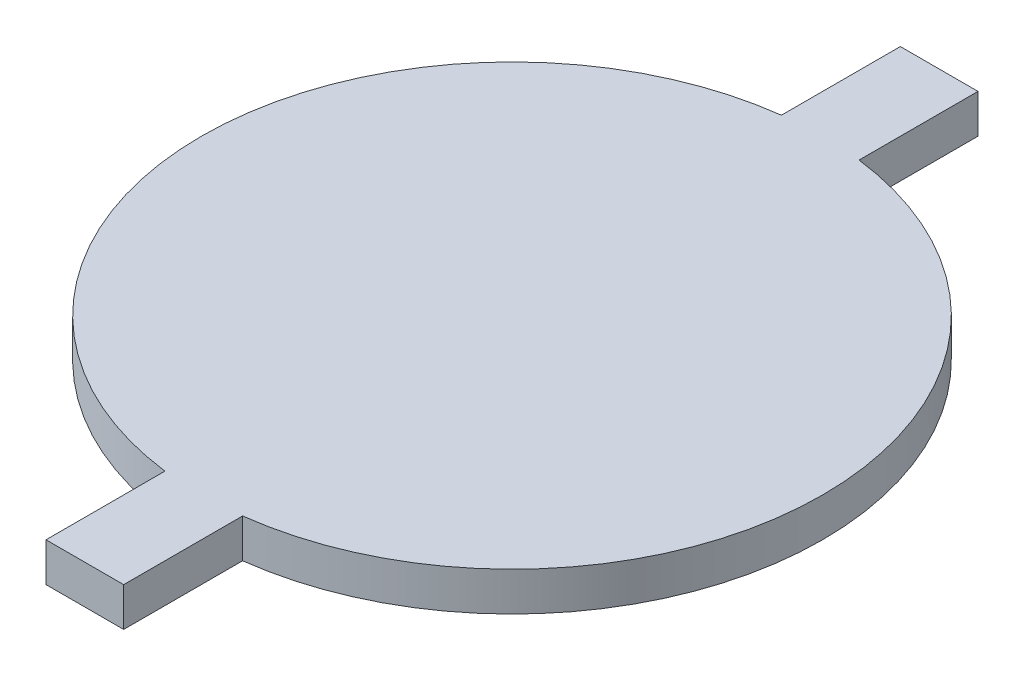
from build123d import *

# Parameters (mm, degrees)
BOSS_EXTRUDE1_DEPTH = 5


with BuildPart() as part:
    # Sketch1 → Boss-Extrude1 (new body)
    with BuildSketch(Plane(origin=(0, 0, 0), x_dir=(1, 0, 0), z_dir=(0, 1, 0))):
        with BuildLine():
            ThreePointArc((-5, 39.686269666), (-40, 0), (-5, -39.686269666))
            Line((-5, -39.686269666), (-5, 39.686269666))
        make_face()
        with BuildLine():
            ThreePointArc((-5, 39.686269666), (0, 40), (5, 39.686269666))
            Line((5, 39.686269666), (5, 55))
            Line((5, 55), (-5, 55))
            Line((-5, 55), (-5, 39.686269666))
        make_face()
        with BuildLine():
            Line((5, 39.686269666), (5, -39.686269666))
            ThreePointArc((5, -39.686269666), (30, -26.457513111), (40, 0))
            ThreePointArc((40, 0), (30, 26.457513111), (5, 39.686269666))
        make_face()
        with BuildLine():
            ThreePointArc((-5, -39.686269666), (0, -40), (5, -39.686269666))
            Line((5, -39.686269666), (5, 39.686269666))
            ThreePointArc((5, 39.686269666), (0, 40), (-5, 39.686269666))
            Line((-5, 39.686269666), (-5, -39.686269666))
        make_face()
        with BuildLine():
            Line((-5, -55), (5, -55))
            Line((5, -55), (5, -39.686269666))
            ThreePointArc((5, -39.686269666), (0, -40), (-5, -39.686269666))
            Line((-5, -39.686269666), (-5, -55))
        make_face()
    extrude(amount=BOSS_EXTRUDE1_DEPTH)


solid = part.part
